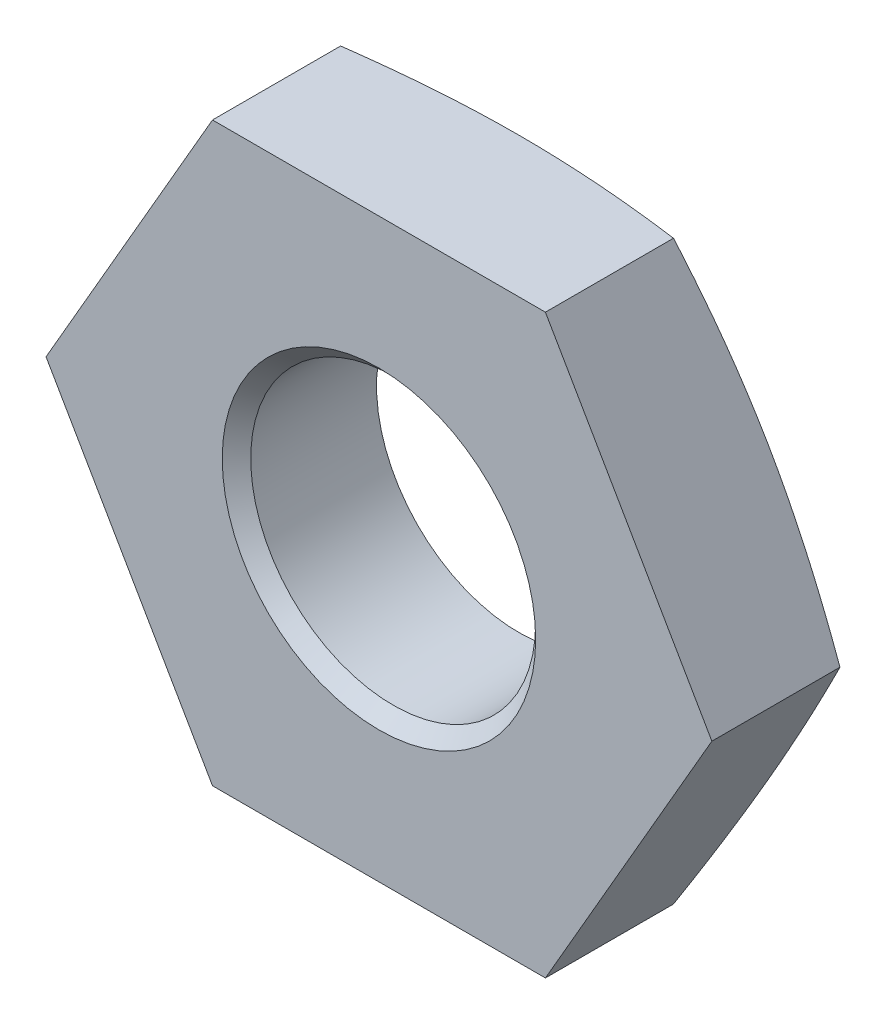
from build123d import *

# Parameters (mm, degrees)
SKETCH1_R     = 1.7295
BASENUT_DEPTH = 1.7
CHAMFER1_SIZE = 0.17295


with BuildPart() as part:
    # Sketch1 → BaseNut (new body)
    with BuildSketch(Plane.XY):
        Polygon((2.020725942, -3.5), (4.041451884, 0), (2.020725942, 3.5), (-2.020725942, 3.5), (-4.041451884, 0), (-2.020725942, -3.5), align=None)
        Circle(SKETCH1_R, mode=Mode.SUBTRACT)
    extrude(amount=-BASENUT_DEPTH)

    # Sketch2 → Double-Chamfer (revolve, cut)
    with BuildSketch(Plane(origin=(0, 0, 0), x_dir=(1, 0, 0), z_dir=(0, 1, 0))):
        Polygon((-4.041451884, 1.7), (-3.5, 1.7), (-4.041451884, 1.554918405), align=None)
    revolve(axis=Axis((0, 0, -3.375940562), (0, 0, 1)), mode=Mode.SUBTRACT)

    # Chamfer1
    chamfer1_edges = [part.edges().sort_by_distance(p)[0] for p in [
        (-1.7295, 0, 0),
    ]]
    chamfer(chamfer1_edges, length=CHAMFER1_SIZE)


solid = part.part
